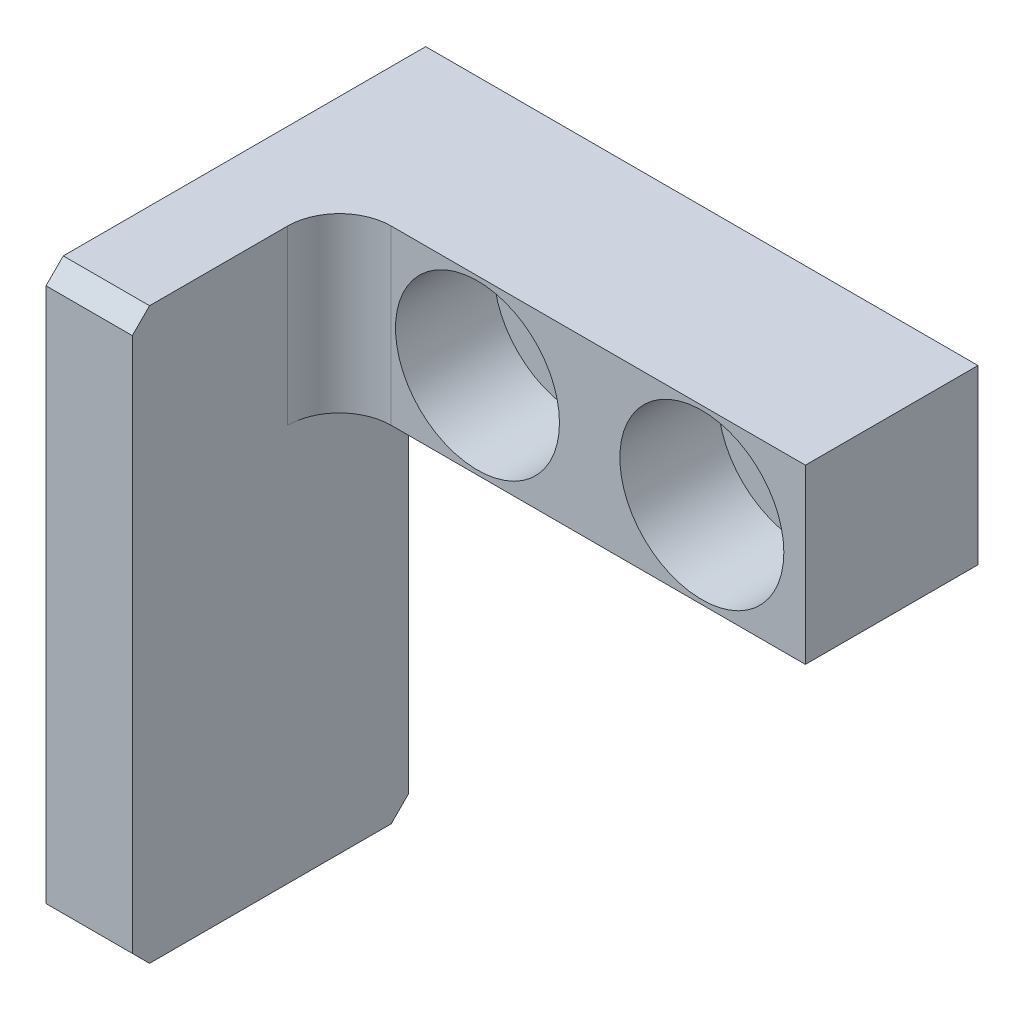
from build123d import *

# Parameters (mm, degrees)
SKETCH_1_W                = 32
SKETCH_1_H                = 22
EXTRUDE_1_DEPTH           = 33
SKETCH_2_W                = 27
SKETCH_2_H                = 12
CUT_EXTRUDE_1_DEPTH       = 39.288379438
SKETCH_4_W                = 10
SKETCH_4_H                = 23
CUT_EXTRUDE_2_DEPTH       = 27
HOLE_WIZARD_1_D           = 5.5
HOLE_WIZARD_1_CBORE_D     = 9.5
HOLE_WIZARD_1_CBORE_DEPTH = 5.7
SKETCH_8_W                = 6
SKETCH_8_H                = 23
CUT_EXTRUDE_3_DEPTH       = 45.034077713
FILLET_1_R                = 3
CHAMFER_1_SIZE            = 1


with BuildPart() as part:
    # 草图1 → 凸台-拉伸1 (new body)
    with BuildSketch(Plane(origin=(0, 0, 0), x_dir=(1, 0, 0), z_dir=(0, 1, 0))):
        Rectangle(SKETCH_1_W, SKETCH_1_H)
    extrude(amount=EXTRUDE_1_DEPTH)

    # 草图2 → 切除-拉伸1 (cut, through all)
    with BuildSketch(Plane(origin=(0, 33, 0), x_dir=(1, 0, 0), z_dir=(0, 1, 0))):
        with Locations((2.5, -5)):
            Rectangle(SKETCH_2_W, SKETCH_2_H)
    extrude(amount=-CUT_EXTRUDE_1_DEPTH, mode=Mode.SUBTRACT)

    # 草图4 → 切除-拉伸2 (cut)
    with BuildSketch(Plane(origin=(16, 0, -21), x_dir=(0, 0, 1), z_dir=(-1, 0, 0))):
        with Locations((15, 11.5)):
            Rectangle(SKETCH_4_W, SKETCH_4_H)
    extrude(amount=CUT_EXTRUDE_2_DEPTH, mode=Mode.SUBTRACT)

    # 打孔尺寸根据内六角圆柱头螺钉的类型1 (through all)
    with Locations(Plane.XY.offset(-1)):
        with Locations((-3, 28), (10, 28)):
            CounterBoreHole(HOLE_WIZARD_1_D / 2, HOLE_WIZARD_1_CBORE_D / 2, HOLE_WIZARD_1_CBORE_DEPTH)

    # 草图8 → 切除-拉伸3 (cut, through all)
    with BuildSketch(Plane(origin=(-11, 0, 0), x_dir=(0, 0, -1), z_dir=(1, 0, 0))):
        with Locations((8, 11.5)):
            Rectangle(SKETCH_8_W, SKETCH_8_H)
    extrude(amount=-CUT_EXTRUDE_3_DEPTH, mode=Mode.SUBTRACT)

    # 圆角1
    fillet_1_edges = [part.edges().sort_by_distance(p)[0] for p in [
        (-11, 28, -1),
    ]]
    fillet(fillet_1_edges, radius=FILLET_1_R)

    # 倒角1
    chamfer_1_edges = [part.edges().sort_by_distance(p)[0] for p in [
        (-13.5, 33, 11),
        (-13.5, 0, 11),
        (-13.5, 0, -5),
    ]]
    chamfer(chamfer_1_edges, length=CHAMFER_1_SIZE)


solid = part.part
